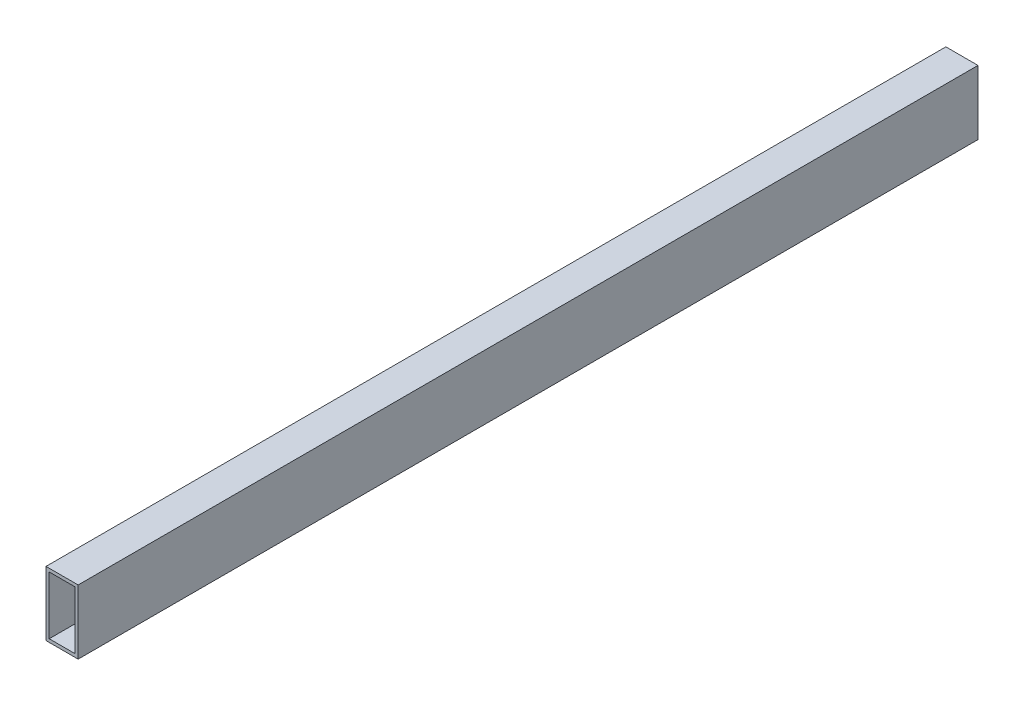
from build123d import *

# Parameters (mm, degrees)
SKETCH1_W           = 10
SKETCH1_H           = 20
SKETCH1_W_2         = 8
SKETCH1_H_2         = 18
BOSS_EXTRUDE1_DEPTH = 280


with BuildPart() as part:
    # Sketch1 → Boss-Extrude1 (new body)
    with BuildSketch(Plane.XY):
        Rectangle(SKETCH1_W, SKETCH1_H)
        Rectangle(SKETCH1_W_2, SKETCH1_H_2, mode=Mode.SUBTRACT)
    extrude(amount=BOSS_EXTRUDE1_DEPTH)


solid = part.part
